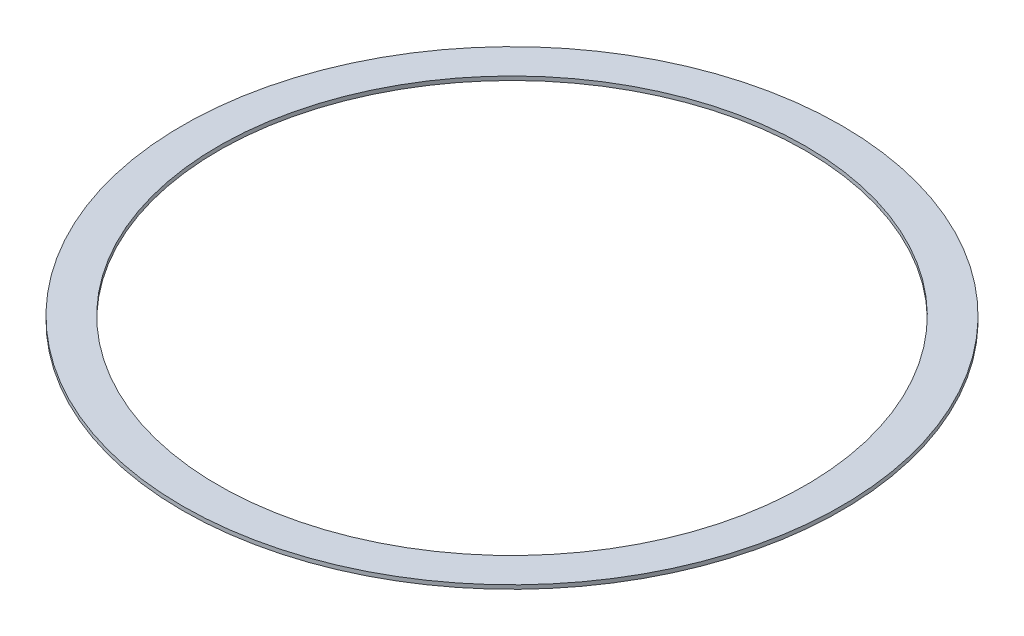
from build123d import *

# Parameters (mm, degrees)
SKETCH1_R           = 64.135
SKETCH1_R_2         = 57.15
BOSS_EXTRUDE1_DEPTH = 0.762


with BuildPart() as part:
    # Sketch1 → Boss-Extrude1 (new body)
    with BuildSketch(Plane(origin=(0, 0, 0), x_dir=(1, 0, 0), z_dir=(0, 1, 0))):
        with Locations(Location((0, 0, 0), (0, 0, 90))):
            Circle(SKETCH1_R)
        with Locations(Location((0, 0, 0), (0, 0, 90))):
            Circle(SKETCH1_R_2, mode=Mode.SUBTRACT)
    extrude(amount=BOSS_EXTRUDE1_DEPTH)


solid = part.part
